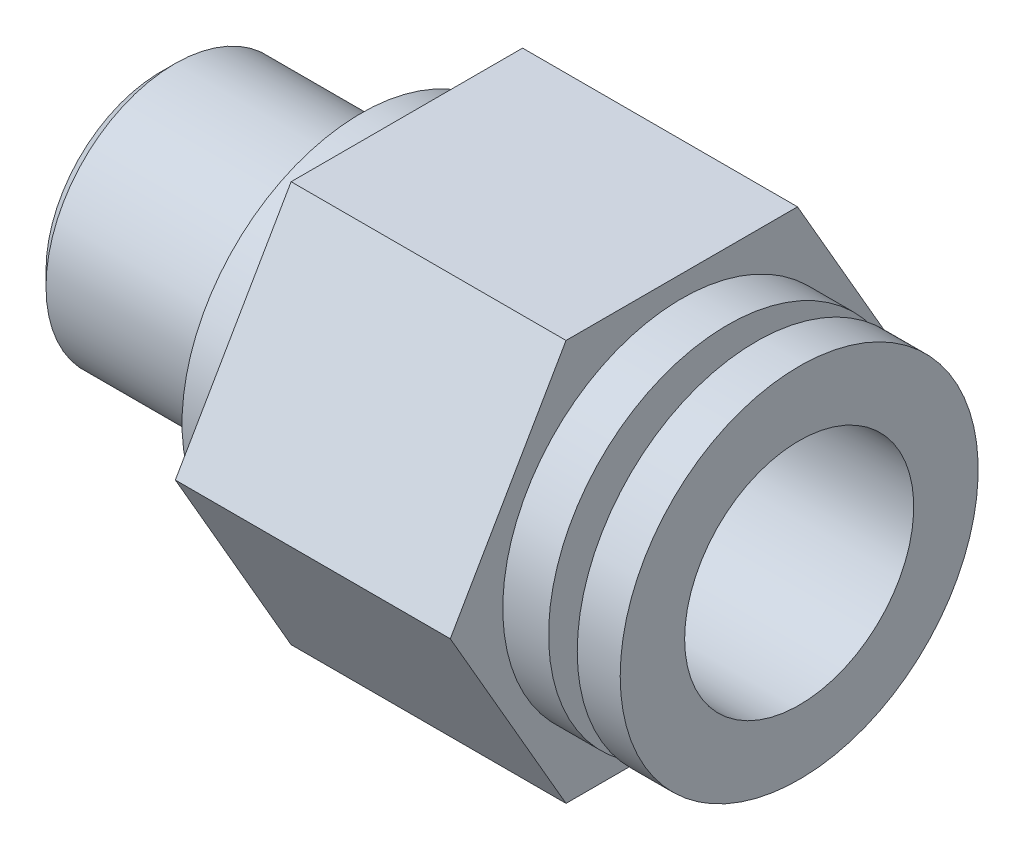
from build123d import *

# Parameters (mm, degrees)
SKETCH2_R          = 9.921875
EXTRUDE1_DEPTH     = 10.16
EXTRUDE2_DEPTH     = 7.62
SKETCH4_R          = 7.14375
EXTRUDE3_DEPTH     = 11.1125
CHAMFER1_SIZE      = 0.79375
SKETCH5_R          = 3.571875
CUT_EXTRUDE1_DEPTH = 28.215016458
CUT_EXTRUDE2_REACH = 29.215
SKETCH6_R          = 7.14375


with BuildPart() as part:
    # Sketch2 → Extrude1 (new, symmetric)
    with BuildSketch(Plane(origin=(0, 0, 0), x_dir=(0, 0, -1), z_dir=(1, 0, 0))):
        Circle(SKETCH2_R)
    extrude(amount=EXTRUDE1_DEPTH, both=True)

    # Sketch3 → Extrude2 (add, symmetric)
    with BuildSketch(Plane(origin=(0, 0, 0), x_dir=(0, 0, -1), z_dir=(1, 0, 0))):
        Polygon((12.831609733, 0), (6.415804866, 11.1125), (-6.415804866, 11.1125), (-12.831609733, 0), (-6.415804866, -11.1125), (6.415804866, -11.1125), align=None)
    extrude(amount=EXTRUDE2_DEPTH, both=True)

    # Sketch4 → Extrude3 (add)
    with BuildSketch(Plane.ZY.offset(10.16)):
        Circle(SKETCH4_R)
    extrude(amount=EXTRUDE3_DEPTH)

    # Chamfer1
    chamfer1_edges = [part.edges().sort_by_distance(p)[0] for p in [
        (-21.2725, 0, -7.14375),
    ]]
    chamfer(chamfer1_edges, length=CHAMFER1_SIZE)

    # Sketch5 → Cut-Extrude1 (cut, through all)
    with BuildSketch(Plane(origin=(0, 0, 0), x_dir=(0, 0, -1), z_dir=(1, 0, 0))):
        Circle(SKETCH5_R)
    extrude(amount=-CUT_EXTRUDE1_DEPTH, mode=Mode.SUBTRACT)

    # Sketch6 → Cut-Extrude2 (cut, up to next)
    with BuildSketch(Plane(origin=(0, 0, 0), x_dir=(0, 0, -1), z_dir=(1, 0, 0)), mode=Mode.PRIVATE) as cut_extrude2_sk1:
        Circle(SKETCH6_R)
    cut_extrude2_tool1 = extrude(cut_extrude2_sk1.sketch, amount=CUT_EXTRUDE2_REACH, mode=Mode.PRIVATE) & part.part
    add(cut_extrude2_tool1.solids().sort_by_distance((0, 0, 0))[0], mode=Mode.SUBTRACT)


with BuildPart() as body_2:
    # Sketch7 → Revolve1 (revolve)
    with BuildSketch(Plane.XY):
        Polygon((0, 7.14375), (11.7475, 7.14375), (11.7475, 9.921875), (14.12875, 9.921875), (14.12875, 6.35), (0, 6.35), align=None)
    revolve(axis=Axis((0, 0, 0), (1, 0, 0)))


solid = Compound([part.part, body_2.part])
